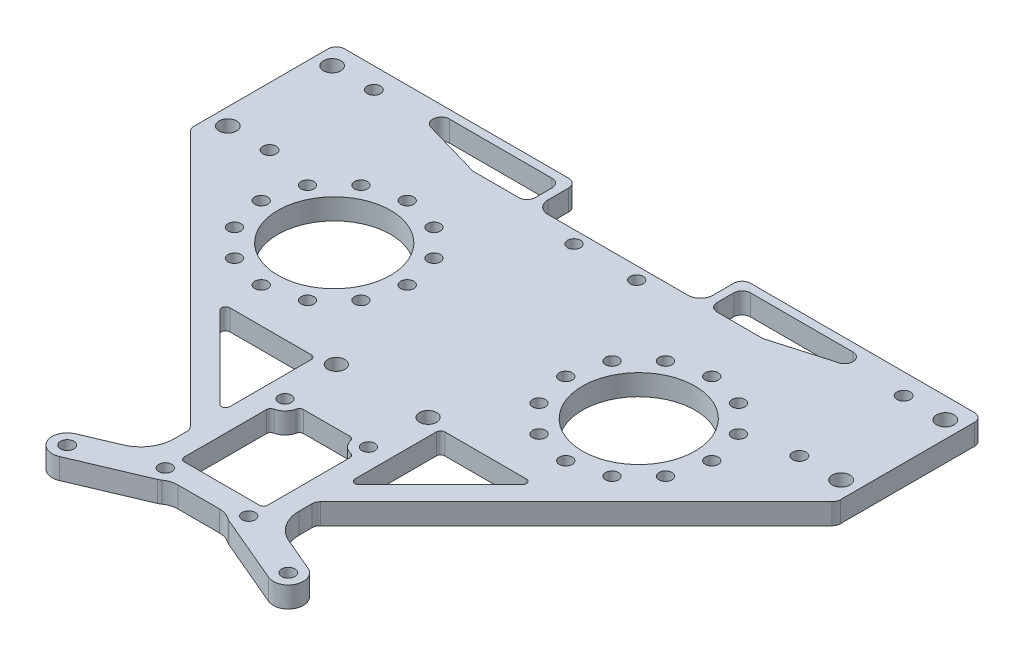
from build123d import *

# Parameters (mm, degrees)
SKETCH_1_W          = 155
SKETCH_1_H          = 60.5
SKETCH_1_R          = 13.5
SKETCH_1_R_2        = 1.55
EXTRUDE_1_DEPTH     = 5
SKETCH_3_W          = 30
SKETCH_3_H          = 40
EXTRUDE_2_DEPTH     = 5
SKETCH_4_W          = 155
SKETCH_4_H          = 10
EXTRUDE_3_DEPTH     = 5
CUT_EXTRUDE_1_DEPTH = 104.885754558
SKETCH_6_R          = 2.1
CUT_EXTRUDE_2_DEPTH = 104.885754558
SKETCH_7_R          = 1.55
SKETCH_7_R_2        = 2.05
CUT_EXTRUDE_3_DEPTH = 104.885754558
EXTRUDE_6_DEPTH     = 5
CUT_EXTRUDE_4_DEPTH = 5
SKETCH_13_R         = 1.55
CUT_EXTRUDE_5_DEPTH = 104.885754558
FILLET_1_R          = 1
FILLET_2_R          = 2
EXTRUDE_8_DEPTH     = 5
FILLET_3_R          = 2
FILLET_4_R          = 3
SKETCH_15_R         = 1.55
SKETCH_15_R_2       = 1.6
EXTRUDE_9_DEPTH     = 5
FILLET_5_R          = 5
FILLET_6_R          = 8
SKETCH_16_R         = 1.6
CUT_EXTRUDE_6_DEPTH = 110.786201319


with BuildPart() as part:
    # 草图1 → 凸台-拉伸1 (new body)
    with BuildSketch(Plane(origin=(0, 0, 0), x_dir=(1, 0, 0), z_dir=(0, 1, 0))):
        with Locations((0, 1.25)):
            Rectangle(SKETCH_1_W, SKETCH_1_H)
        with Locations(Location((36.5, 0, 0), (0, 0, 270))):
            Circle(SKETCH_1_R, mode=Mode.SUBTRACT)
        with Locations(Location((-36.5, 0, 0), (0, 0, 270))):
            Circle(SKETCH_1_R, mode=Mode.SUBTRACT)
        with Locations(Location((36.5, 17.5, 0), (0, 0, 270))):
            Circle(SKETCH_1_R_2, mode=Mode.SUBTRACT)
        with Locations(Location((45.25, 15.155444566, 0), (0, 0, 270))):
            Circle(SKETCH_1_R_2, mode=Mode.SUBTRACT)
        with Locations(Location((51.655444566, 8.75, 0), (0, 0, 270))):
            Circle(SKETCH_1_R_2, mode=Mode.SUBTRACT)
        with Locations(Location((54, 0, 0), (0, 0, 270))):
            Circle(SKETCH_1_R_2, mode=Mode.SUBTRACT)
        with Locations(Location((51.655444566, -8.75, 0), (0, 0, 270))):
            Circle(SKETCH_1_R_2, mode=Mode.SUBTRACT)
        with Locations(Location((45.25, -15.155444566, 0), (0, 0, 270))):
            Circle(SKETCH_1_R_2, mode=Mode.SUBTRACT)
        with Locations(Location((36.5, -17.5, 0), (0, 0, 270))):
            Circle(SKETCH_1_R_2, mode=Mode.SUBTRACT)
        with Locations(Location((27.75, -15.155444566, 0), (0, 0, 270))):
            Circle(SKETCH_1_R_2, mode=Mode.SUBTRACT)
        with Locations(Location((21.344555434, -8.75, 0), (0, 0, 270))):
            Circle(SKETCH_1_R_2, mode=Mode.SUBTRACT)
        with Locations(Location((19, 0, 0), (0, 0, 270))):
            Circle(SKETCH_1_R_2, mode=Mode.SUBTRACT)
        with Locations(Location((21.344555434, 8.75, 0), (0, 0, 270))):
            Circle(SKETCH_1_R_2, mode=Mode.SUBTRACT)
        with Locations(Location((27.75, 15.155444566, 0), (0, 0, 270))):
            Circle(SKETCH_1_R_2, mode=Mode.SUBTRACT)
        with Locations(Location((-36.5, 17.5, 0), (0, 0, 90))):
            Circle(SKETCH_1_R_2, mode=Mode.SUBTRACT)
        with Locations(Location((-27.75, 15.155444566, 0), (0, 0, 90))):
            Circle(SKETCH_1_R_2, mode=Mode.SUBTRACT)
        with Locations(Location((-21.344555434, 8.75, 0), (0, 0, 90))):
            Circle(SKETCH_1_R_2, mode=Mode.SUBTRACT)
        with Locations(Location((-19, 0, 0), (0, 0, 90))):
            Circle(SKETCH_1_R_2, mode=Mode.SUBTRACT)
        with Locations(Location((-21.344555434, -8.75, 0), (0, 0, 90))):
            Circle(SKETCH_1_R_2, mode=Mode.SUBTRACT)
        with Locations(Location((-27.75, -15.155444566, 0), (0, 0, 90))):
            Circle(SKETCH_1_R_2, mode=Mode.SUBTRACT)
        with Locations(Location((-36.5, -17.5, 0), (0, 0, 90))):
            Circle(SKETCH_1_R_2, mode=Mode.SUBTRACT)
        with Locations(Location((-45.25, -15.155444566, 0), (0, 0, 90))):
            Circle(SKETCH_1_R_2, mode=Mode.SUBTRACT)
        with Locations(Location((-51.655444566, -8.75, 0), (0, 0, 90))):
            Circle(SKETCH_1_R_2, mode=Mode.SUBTRACT)
        with Locations(Location((-54, 0, 0), (0, 0, 90))):
            Circle(SKETCH_1_R_2, mode=Mode.SUBTRACT)
        with Locations(Location((-51.655444566, 8.75, 0), (0, 0, 90))):
            Circle(SKETCH_1_R_2, mode=Mode.SUBTRACT)
        with Locations(Location((-45.25, 15.155444566, 0), (0, 0, 90))):
            Circle(SKETCH_1_R_2, mode=Mode.SUBTRACT)
    extrude(amount=EXTRUDE_1_DEPTH)

    # 草图3 → 凸台-拉伸2 (add)
    with BuildSketch(Plane(origin=(0, 5, 0), x_dir=(1, 0, 0), z_dir=(0, 1, 0))):
        with Locations((0, -49)):
            Rectangle(SKETCH_3_W, SKETCH_3_H)
    extrude(amount=-EXTRUDE_2_DEPTH)

    # 草图4 → 凸台-拉伸3 (add)
    with BuildSketch(Plane(origin=(0, 5, 0), x_dir=(1, 0, 0), z_dir=(0, 1, 0))):
        with Locations((0, 36.5)):
            Rectangle(SKETCH_4_W, SKETCH_4_H)
    extrude(amount=-EXTRUDE_3_DEPTH)

    # 草图5 → 切除-拉伸1 (cut, through all)
    with BuildSketch(Plane.XZ):
        Polygon((-77.5, 29), (-77.5, -6.5), (-42, 29), align=None)
        Polygon((-34.75, -31.5), (-69.5, -41.5), (0, -41.5), (0, -31.5), align=None)
    cut_extrude_1 = extrude(amount=-CUT_EXTRUDE_1_DEPTH, mode=Mode.SUBTRACT)

    # 镜向1: 切除-拉伸1 across plane
    add(cut_extrude_1.mirror(Plane(origin=(0, 0, 0), x_dir=(0, 0, 1), z_dir=(1, 0, 0))), mode=Mode.SUBTRACT)

    # 草图6 → 切除-拉伸2 (cut, through all)
    with BuildSketch(Plane(origin=(0, 5, 0), x_dir=(1, 0, 0), z_dir=(0, 1, 0))):
        with Locations(Location((-73.5, 36.5, 0), (0, 0, 270))):
            Circle(SKETCH_6_R)
        with Locations(Location((-73.5, 11.5, 0), (0, 0, 270))):
            Circle(SKETCH_6_R)
        with Locations(Location((73.5, 11.5, 0), (0, 0, 90))):
            Circle(SKETCH_6_R)
        with Locations(Location((73.5, 36.5, 0), (0, 0, 90))):
            Circle(SKETCH_6_R)
    extrude(amount=-CUT_EXTRUDE_2_DEPTH, mode=Mode.SUBTRACT)

    # 草图7 → 切除-拉伸3 (cut, through all)
    with BuildSketch(Plane(origin=(0, 5, 0), x_dir=(1, 0, 0), z_dir=(0, 1, 0))):
        with Locations(Location((7.5, 28.5, 0), (0, 0, 270))):
            Circle(SKETCH_7_R)
        with Locations(Location((-7.5, 28.5, 0), (0, 0, 270))):
            Circle(SKETCH_7_R)
        with Locations(Location((11, -25, 0), (0, 0, 270))):
            Circle(SKETCH_7_R_2)
        with Locations(Location((-11, -25, 0), (0, 0, 270))):
            Circle(SKETCH_7_R_2)
    extrude(amount=-CUT_EXTRUDE_3_DEPTH, mode=Mode.SUBTRACT)

    # 草图10 → 凸台-拉伸6 (add)
    with BuildSketch(Plane(origin=(0, 5, 0), x_dir=(1, 0, 0), z_dir=(0, 1, 0))):
        Polygon((-42, -29), (-15, -56), (-15, -29), align=None)
        Polygon((15, -29), (15, -56), (42, -29), align=None)
    extrude(amount=-EXTRUDE_6_DEPTH)

    # 草图11 → 切除-拉伸4 (cut)
    with BuildSketch(Plane(origin=(0, 5, 0), x_dir=(1, 0, 0), z_dir=(0, 1, 0))):
        Polygon((-15, -26), (-37.928932188, -26), (-15, -48.928932188), align=None)
        Polygon((15, -26), (15, -48.928932188), (37.928932188, -26), align=None)
    extrude(amount=-CUT_EXTRUDE_4_DEPTH, mode=Mode.SUBTRACT)

    # 草图13 → 切除-拉伸5 (cut, through all)
    with BuildSketch(Plane(origin=(0, 5, 0), x_dir=(1, 0, 0), z_dir=(0, 1, 0))):
        with BuildLine():
            Line((-10, -63.45), (10, -63.45))
            Line((10, -63.45), (10, -41.85))
            ThreePointArc((10, -41.85), (7.489770927, -40.810229073), (6.45, -38.3))
            Line((6.45, -38.3), (-6.45, -38.3))
            ThreePointArc((-6.45, -38.3), (-7.489770927, -40.810229073), (-10, -41.85))
            Line((-10, -41.85), (-10, -63.45))
        make_face()
        with Locations(Location((10, -67, 0), (0, 0, 270))):
            Circle(SKETCH_13_R)
        with Locations(Location((-10, -67, 0), (0, 0, 270))):
            Circle(SKETCH_13_R)
        with Locations(Location((10, -38.3, 0), (0, 0, 270))):
            Circle(SKETCH_13_R)
        with Locations(Location((-10, -38.3, 0), (0, 0, 270))):
            Circle(SKETCH_13_R)
    extrude(amount=-CUT_EXTRUDE_5_DEPTH, mode=Mode.SUBTRACT)

    # 圆角1
    fillet_1_edges = [part.edges().sort_by_distance(p)[0] for p in [
        (-15, 2.5, 26),
        (-15, 2.5, 48.928932188),
        (-37.928932188, 2.5, 26),
        (15, 2.5, 26),
        (37.928932188, 2.5, 26),
        (15, 2.5, 48.928932188),
        (6.45, 2.5, 38.3),
        (10, 2.5, 41.85),
        (10, 2.5, 63.45),
        (-10, 2.5, 63.45),
        (-10, 2.5, 41.85),
        (-6.45, 2.5, 38.3),
    ]]
    fillet(fillet_1_edges, radius=FILLET_1_R)

    # 圆角2
    fillet_2_edges = [part.edges().sort_by_distance(p)[0] for p in [
        (-15, 2.5, 69),
        (15, 2.5, 69),
        (-77.5, 2.5, -41.5),
        (77.5, 2.5, -41.5),
        (-77.5, 2.5, -6.5),
        (-69.5, 2.5, -41.5),
        (-34.75, 2.5, -31.5),
        (77.5, 2.5, -6.5),
        (34.75, 2.5, -31.5),
        (69.5, 2.5, -41.5),
        (-15, 2.5, 56),
        (15, 2.5, 56),
    ]]
    fillet(fillet_2_edges, radius=FILLET_2_R)

    # 草图14 → 凸台-拉伸8 (add)
    with BuildSketch(Plane(origin=(0, 5, 0), x_dir=(1, 0, 0), z_dir=(0, 1, 0))):
        with BuildLine():
            Line((-19.782046737, 41.5), (-69.782046737, 41.5))
            ThreePointArc((-69.782046737, 41.5), (-69.502763464, 41.480404215), (-69.228952966, 41.422000853))
            Line((-69.228952966, 41.422000853), (-62.55, 39.5))
            Line((-62.55, 39.5), (-21.782046737, 39.5))
            Line((-21.782046737, 39.5), (-21.782046737, 31.5))
            Line((-21.782046737, 31.5), (-19.782046737, 31.5))
            Line((-19.782046737, 31.5), (-19.782046737, 41.5))
        make_face()
    extrude_8 = extrude(amount=-EXTRUDE_8_DEPTH)

    # 镜向2: 凸台-拉伸8 across plane
    add(extrude_8.mirror(Plane(origin=(0, 0, 0), x_dir=(0, 0, 1), z_dir=(1, 0, 0))))

    # 圆角3
    fillet_3_edges = [part.edges().sort_by_distance(p)[0] for p in [
        (-19.782046737, 2.5, -41.5),
        (-21.782046737, 2.5, -31.5),
        (-21.782046737, 2.5, -39.5),
        (-62.55, 2.5, -39.5),
        (62.55, 2.5, -39.5),
        (21.782046737, 2.5, -39.5),
        (21.782046737, 2.5, -31.5),
        (19.782046737, 2.5, -41.5),
    ]]
    fillet(fillet_3_edges, radius=FILLET_3_R)

    # 圆角4
    fillet_4_edges = [part.edges().sort_by_distance(p)[0] for p in [
        (-19.782046737, 2.5, -31.5),
        (19.782046737, 2.5, -31.5),
    ]]
    fillet(fillet_4_edges, radius=FILLET_4_R)

    # 草图15 → 凸台-拉伸9 (add)
    # profile 1 of 2: a face of its own
    with BuildSketch(Plane(origin=(0, 5, 0), x_dir=(1, 0, 0), z_dir=(0, 1, 0))):
        with BuildLine():
            Line((8.594020551, -70.314094415), (25.094020551, -77.314094415))
            ThreePointArc((25.094020551, -77.314094415), (29.814094415, -75.405979449), (27.905979449, -70.685905585))
            Line((27.905979449, -70.685905585), (11.405979449, -63.685905585))
            ThreePointArc((11.405979449, -63.685905585), (6.685905585, -65.594020551), (8.594020551, -70.314094415))
        make_face()
        with Locations(Location((10, -67, 0), (0, 0, 270))):
            Circle(SKETCH_15_R, mode=Mode.SUBTRACT)
        with Locations(Location((26.5, -74, 0), (0, 0, 270))):
            Circle(SKETCH_15_R_2, mode=Mode.SUBTRACT)
    # profile 2 of 2: a face of its own
    with BuildSketch(Plane(origin=(0, 5, 0), x_dir=(1, 0, 0), z_dir=(0, 1, 0))):
        with BuildLine():
            Line((-11.405979449, -63.685905585), (-27.905979449, -70.685905585))
            ThreePointArc((-27.905979449, -70.685905585), (-29.814094415, -75.405979449), (-25.094020551, -77.314094415))
            Line((-25.094020551, -77.314094415), (-8.594020551, -70.314094415))
            ThreePointArc((-8.594020551, -70.314094415), (-6.685905585, -65.594020551), (-11.405979449, -63.685905585))
        make_face()
        with Locations(Location((-10, -67, 0), (0, 0, 270))):
            Circle(SKETCH_15_R, mode=Mode.SUBTRACT)
        with Locations(Location((-26.5, -74, 0), (0, 0, 270))):
            Circle(SKETCH_15_R_2, mode=Mode.SUBTRACT)
    extrude(amount=-EXTRUDE_9_DEPTH)

    # 圆角5
    fillet_5_edges = [part.edges().sort_by_distance(p)[0] for p in [
        (7.006674091, 2.5, 69),
        (-7.006674091, 2.5, 69),
    ]]
    fillet(fillet_5_edges, radius=FILLET_5_R)

    # 圆角6
    fillet_6_edges = [part.edges().sort_by_distance(p)[0] for p in [
        (15, 2.5, 65.210641577),
        (-15, 2.5, 65.210641577),
    ]]
    fillet(fillet_6_edges, radius=FILLET_6_R)

    # 草图16 → 切除-拉伸6 (cut, through all)
    with BuildSketch(Plane(origin=(0, 5, 0), x_dir=(1, 0, 0), z_dir=(0, 1, 0))):
        with Locations(Location((-63.5, 36.5, 0), (0, 0, 270))):
            Circle(SKETCH_16_R)
        with Locations(Location((-63.5, 11.5, 0), (0, 0, 270))):
            Circle(SKETCH_16_R)
        with Locations(Location((63.5, 11.5, 0), (0, 0, 270))):
            Circle(SKETCH_16_R)
        with Locations(Location((63.5, 36.5, 0), (0, 0, 270))):
            Circle(SKETCH_16_R)
    extrude(amount=-CUT_EXTRUDE_6_DEPTH, mode=Mode.SUBTRACT)


solid = part.part
